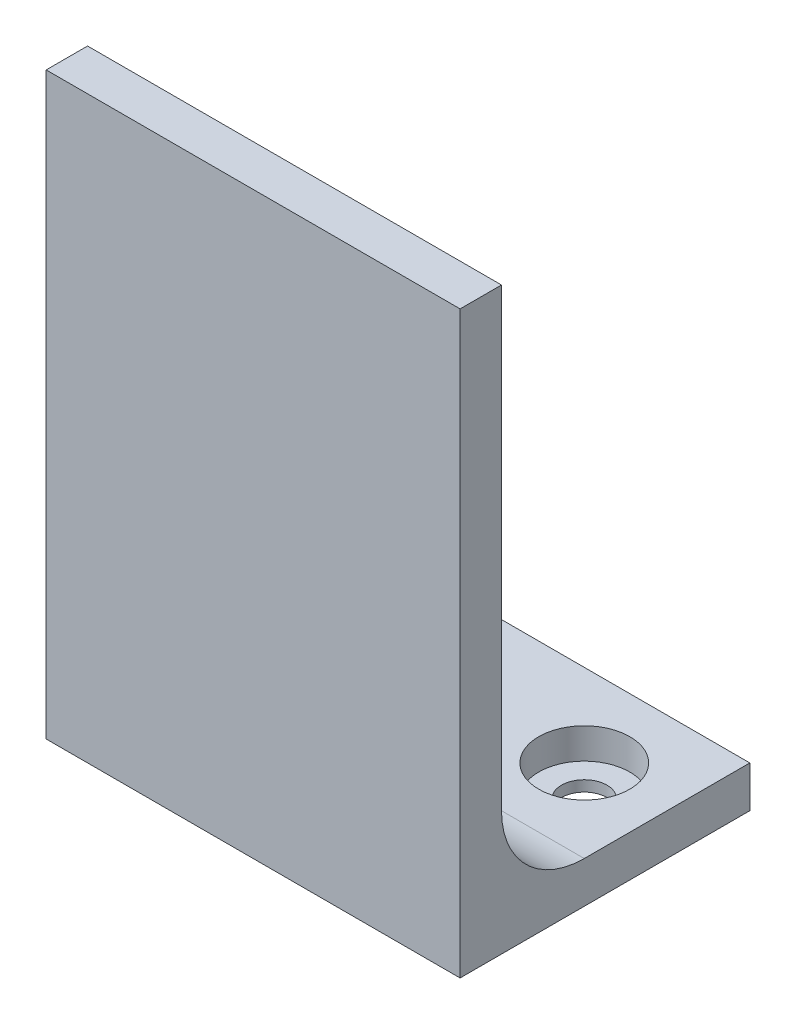
from build123d import *

# Parameters (mm, degrees)
BOSS_EXTRUDE1_DEPTH                      = 50
CBORE_FOR_M5_PAN_HEAD_SCREW1_D           = 5.5
CBORE_FOR_M5_PAN_HEAD_SCREW1_DEPTH       = 30
CBORE_FOR_M5_PAN_HEAD_SCREW1_CBORE_D     = 11
CBORE_FOR_M5_PAN_HEAD_SCREW1_CBORE_DEPTH = 3.7
CBORE_FOR_M5_PAN_HEAD_SCREW1_TIP         = 1.652366702


with BuildPart() as part:
    # Sketch2 → Boss-Extrude1 (new body)
    with BuildSketch(Plane(origin=(0, 0, 0), x_dir=(0, 0, -1), z_dir=(1, 0, 0))):
        with BuildLine():
            Line((0, 0), (0, 70))
            Line((0, 70), (5, 70))
            Line((5, 70), (5, 15))
            ThreePointArc((5, 15), (7.928932188, 7.928932188), (15, 5))
            Line((15, 5), (35, 5))
            Line((35, 5), (35, 0))
            Line((35, 0), (0, 0))
        make_face()
    extrude(amount=BOSS_EXTRUDE1_DEPTH)

    # CBORE for M5 Pan Head Screw1
    with Locations(Plane(origin=(0, 5, 0), x_dir=(1, 0, 0), z_dir=(0, 1, 0))):
        with Locations((40, 25), (10, 25)):
            CounterBoreHole(CBORE_FOR_M5_PAN_HEAD_SCREW1_D / 2, CBORE_FOR_M5_PAN_HEAD_SCREW1_CBORE_D / 2, CBORE_FOR_M5_PAN_HEAD_SCREW1_CBORE_DEPTH, depth=CBORE_FOR_M5_PAN_HEAD_SCREW1_DEPTH)
            with Locations((0, 0, -(CBORE_FOR_M5_PAN_HEAD_SCREW1_DEPTH + CBORE_FOR_M5_PAN_HEAD_SCREW1_TIP / 2))):  # 118° drill point
                Cone(0, CBORE_FOR_M5_PAN_HEAD_SCREW1_D / 2, CBORE_FOR_M5_PAN_HEAD_SCREW1_TIP, mode=Mode.SUBTRACT)


solid = part.part
